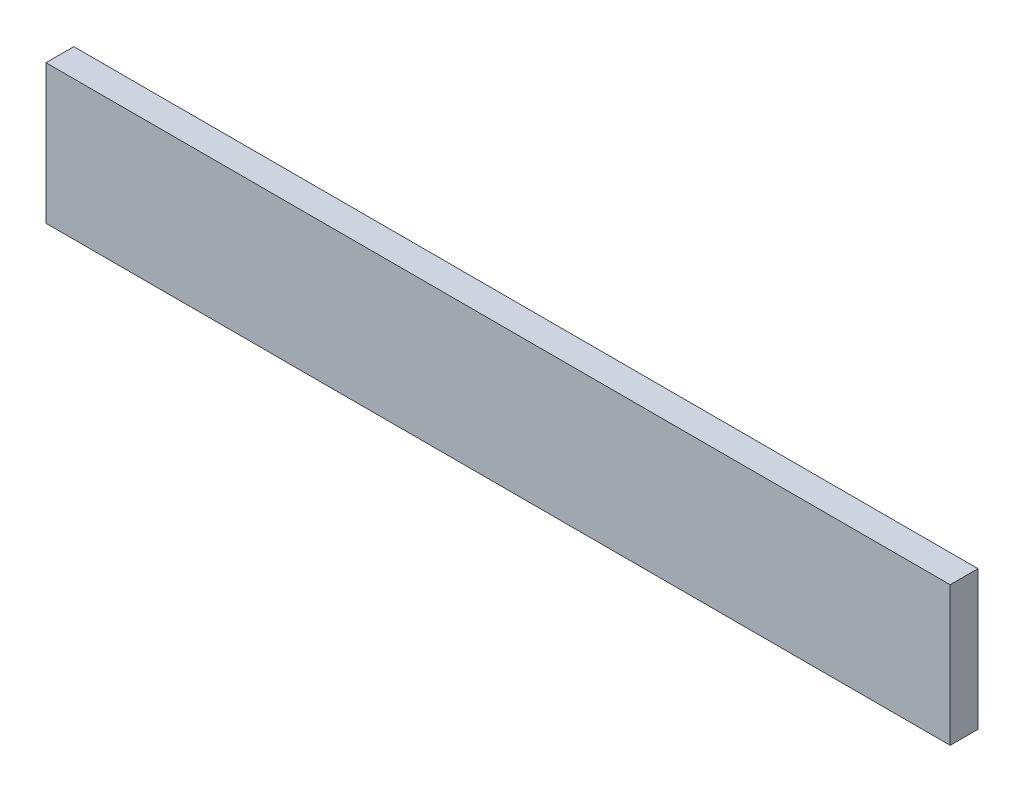
from build123d import *

# Parameters (mm, degrees)
SKETCH1_W           = 165.1
SKETCH1_H           = 25.4
BOSS_EXTRUDE1_DEPTH = 2.54


with BuildPart() as part:
    # Sketch1 → Boss-Extrude1 (new, symmetric)
    with BuildSketch(Plane.XY):
        with Locations((82.55, 12.7)):
            Rectangle(SKETCH1_W, SKETCH1_H)
    extrude(amount=BOSS_EXTRUDE1_DEPTH, both=True)


solid = part.part
